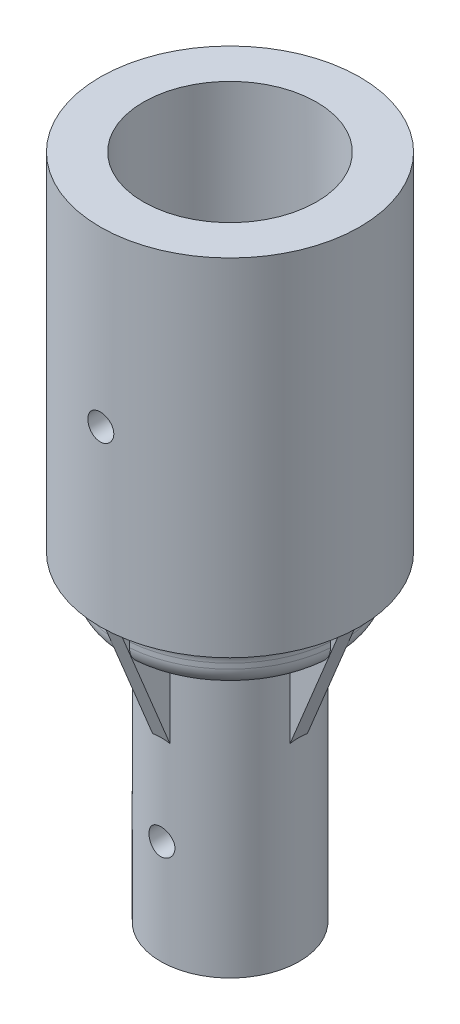
from build123d import *

# Parameters (mm, degrees)
SKETCH1_R           = 8
SKETCH1_R_2         = 4
BOSS_EXTRUDE1_DEPTH = 32
SKETCH2_R           = 12.654046274
BOSS_EXTRUDE2_DEPTH = 5
SKETCH3_R           = 15
SKETCH3_R_2         = 10
BOSS_EXTRUDE3_DEPTH = 40
FILLET1_R           = 2.2
SKETCH4_R           = 1.5
CUT_EXTRUDE1_DEPTH  = 20
RIB5_REACH          = 81.869
SKETCH5_WALL_W      = 180.122060892
SKETCH5_WALL_H      = 2
CIRPATTERN1_COUNT   = 4


with BuildPart() as part:
    # Sketch1 → Boss-Extrude1 (new body)
    with BuildSketch(Plane(origin=(0, 0, 0), x_dir=(1, 0, 0), z_dir=(0, 1, 0))):
        with Locations(Location((0, 0, 0), (0, 0, 270))):
            Circle(SKETCH1_R)
        with Locations(Location((0, 0, 0), (0, 0, 270))):
            Circle(SKETCH1_R_2, mode=Mode.SUBTRACT)
    extrude(amount=BOSS_EXTRUDE1_DEPTH)

    # Sketch2 → Boss-Extrude2 (add)
    with BuildSketch(Plane(origin=(0, 32, 0), x_dir=(1, 0, 0), z_dir=(0, 1, 0))):
        with Locations(Location((0, 0, 0), (0, 0, 270))):
            Circle(SKETCH2_R)
    extrude(amount=BOSS_EXTRUDE2_DEPTH)

    # Sketch3 → Boss-Extrude3 (add)
    with BuildSketch(Plane(origin=(0, 37, 0), x_dir=(1, 0, 0), z_dir=(0, 1, 0))):
        with Locations(Location((0, 0, 0), (0, 0, 270))):
            Circle(SKETCH3_R)
        with Locations(Location((0, 0, 0), (0, 0, 270))):
            Circle(SKETCH3_R_2, mode=Mode.SUBTRACT)
    extrude(amount=BOSS_EXTRUDE3_DEPTH)

    # Fillet1
    fillet1_edges = [part.edges().sort_by_distance(p)[0] for p in [
        (0, 37, -12.654046274),
        (0, 32, -8),
        (0, 32, -12.654046274),
    ]]
    fillet(fillet1_edges, radius=FILLET1_R)

    # Sketch4 → Cut-Extrude1 (cut, symmetric)
    with BuildSketch(Plane.XY):
        with Locations((0, 57)):
            Circle(SKETCH4_R)
        with Locations((0, 12)):
            Circle(SKETCH4_R)
    extrude(amount=CUT_EXTRUDE1_DEPTH, both=True, mode=Mode.SUBTRACT)

    # Sketch5 wall → Rib5 (add, up to next)
    with BuildSketch(Plane(origin=(10.5, 28.5, 0), x_dir=(-0.380749805254, -0.924678098475, 0), z_dir=(0.924678098475, -0.380749805254, 0)), mode=Mode.PRIVATE) as rib5_sk1:
        Rectangle(SKETCH5_WALL_W, SKETCH5_WALL_H)
    rib5_tool1 = extrude(rib5_sk1.sketch, amount=-RIB5_REACH, mode=Mode.PRIVATE) - part.part
    rib5 = rib5_tool1.solids().sort_by_distance((10.5, 28.5, 0))[0]
    add(rib5)

    # CirPattern1: Rib5 ×4 about axis
    cirpattern1_axis = Axis((0, 0, 0), (0, 1, 0))
    for i in range(1, CIRPATTERN1_COUNT):
        add(rib5.rotate(cirpattern1_axis, i * 360 / CIRPATTERN1_COUNT))


solid = part.part
